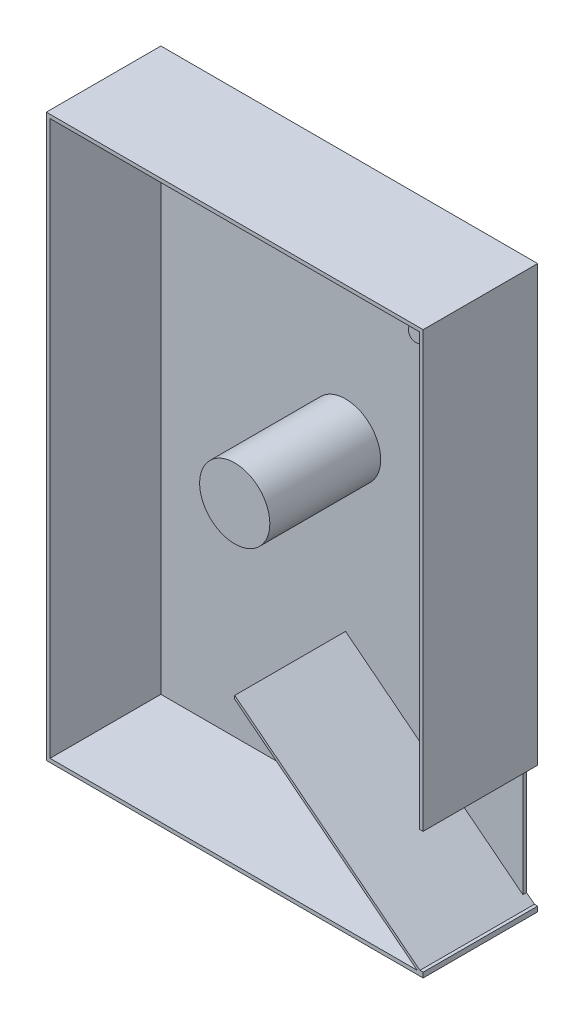
from build123d import *

# Parameters (mm, degrees)
SKETCH_1_W           = 102
SKETCH_1_H           = 152
SKETCH_1_W_2         = 100
SKETCH_1_H_2         = 150
EXTRUDE_1_DEPTH      = 30
EXTRUDE_2_DEPTH      = 76
EXTRUDE_2_DEPTH_BACK = 76
SKETCH_2_W           = 102
SKETCH_2_H           = 1
SKETCH_3_R           = 9.5
EXTRUDE_3_DEPTH      = 30
EXTRUDE_4_DEPTH      = 15
SKETCH_6_W           = 31
SKETCH_6_H           = 33.017960066
CUT_EXTRUDE_1_DEPTH  = 3
EXTRUDE_5_DEPTH      = 31


with BuildPart() as part:
    # 草图1 → 凸台-拉伸1 (new body)
    with BuildSketch(Plane.XY):
        Rectangle(SKETCH_1_W, SKETCH_1_H)
        Rectangle(SKETCH_1_W_2, SKETCH_1_H_2, mode=Mode.SUBTRACT)
    extrude(amount=EXTRUDE_1_DEPTH)

    # 草图2 → 凸台-拉伸2 (add, two sides: drawn at the far end of the back side and taken through both)
    with BuildSketch(Plane(origin=(0, 0, 0), x_dir=(1, 0, 0), z_dir=(0, 1, 0)).offset(-EXTRUDE_2_DEPTH_BACK)):
        with Locations((0, 0.5)):
            Rectangle(SKETCH_2_W, SKETCH_2_H)
    extrude(amount=EXTRUDE_2_DEPTH + EXTRUDE_2_DEPTH_BACK)

    # 草图3 → 凸台-拉伸3 (add)
    with BuildSketch(Plane.XY):
        with Locations((0, 9.764589886)):
            Circle(SKETCH_3_R)
    extrude(amount=EXTRUDE_3_DEPTH)

    # 草图5 → 凸台-拉伸4 (add)
    with BuildSketch(Plane.XY):
        with BuildLine():
            ThreePointArc((36, 59), (35.414213562, 60.414213562), (34, 61))
            Line((34, 61), (34, 59))
            Line((34, 59), (36, 59))
        make_face()
        with BuildLine():
            Line((34, 59), (34, 61))
            ThreePointArc((34, 61), (32.585786438, 57.585786438), (36, 59))
            Line((36, 59), (34, 59))
        make_face()
    extrude(amount=EXTRUDE_4_DEPTH)

    # 草图6 → 切除-拉伸1 (cut)
    with BuildSketch(Plane(origin=(51, 0, 0), x_dir=(0, 0, -1), z_dir=(1, 0, 0))):
        with Locations((-14.5, -58.131256351)):
            Rectangle(SKETCH_6_W, SKETCH_6_H)
    extrude(amount=-CUT_EXTRUDE_1_DEPTH, mode=Mode.SUBTRACT)

    # 草图7 → 凸台-拉伸5 (add)
    with BuildSketch(Plane.XY.offset(30)):
        Polygon((49.826203417, -75.312750473), (51, -75.320118192), (0, -35.235410114), (0, -36.150616776), align=None)
    extrude(amount=-EXTRUDE_5_DEPTH)


solid = part.part
